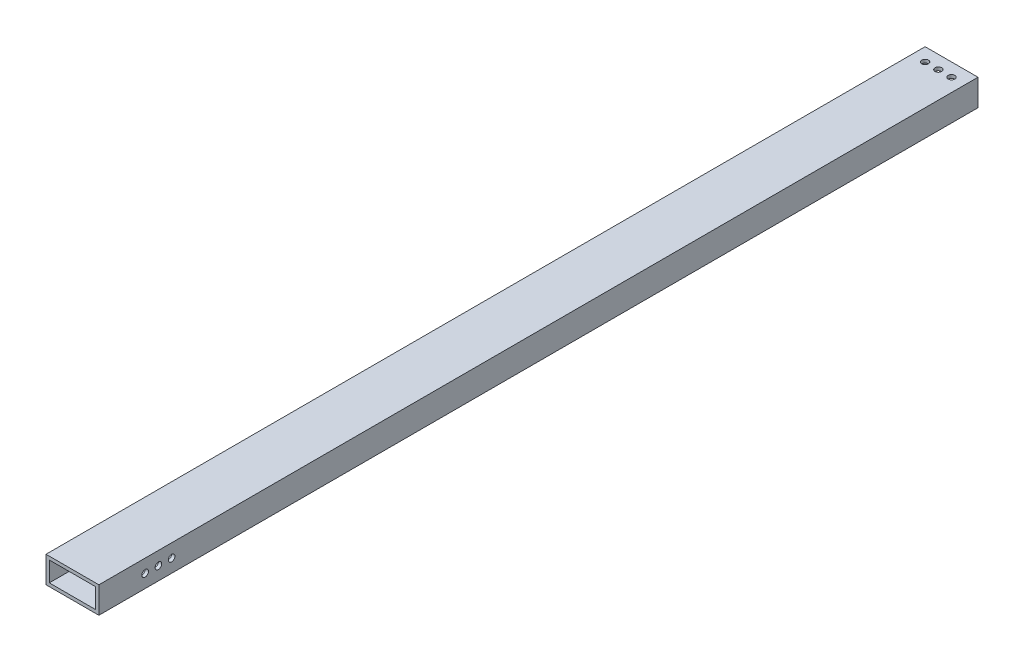
from build123d import *

# Parameters (mm, degrees)
SKETCH1_W                   = 50.8
SKETCH1_H                   = 25.4
SKETCH1_W_2                 = 44.45
SKETCH1_H_2                 = 19.05
BOSS_EXTRUDE1_DEPTH         = 844.55
CUT_EXTRUDE1_DEPTH          = 847.457620026
CUT_EXTRUDE1_DEPTH_BACK     = 847.457620026
SKETCH2_R                   = 3.175
F_1_4_0_25_DIAMETER_HOLE3_D = 6.35


with BuildPart() as part:
    # Sketch1 → Boss-Extrude1 (new body)
    with BuildSketch(Plane.XY):
        with Locations((25.4, 12.7)):
            Rectangle(SKETCH1_W, SKETCH1_H)
        with Locations((25.4, 12.7)):
            Rectangle(SKETCH1_W_2, SKETCH1_H_2, mode=Mode.SUBTRACT)
    extrude(amount=BOSS_EXTRUDE1_DEPTH)

    # Sketch2 → Cut-Extrude1 (cut, two sides: drawn at the far end of the back side and taken through both)
    with BuildSketch(Plane(origin=(50.8, 0, 0), x_dir=(0, 0, -1), z_dir=(1, 0, 0)).offset(-CUT_EXTRUDE1_DEPTH_BACK)):
        with Locations(Location((-800.1, 12.7, 0), (0, 0, 180))):
            Circle(SKETCH2_R)
        with Locations(Location((-787.4, 12.7, 0), (0, 0, 180))):
            Circle(SKETCH2_R)
        with Locations(Location((-774.7, 12.7, 0), (0, 0, 180))):
            Circle(SKETCH2_R)
    extrude(amount=CUT_EXTRUDE1_DEPTH + CUT_EXTRUDE1_DEPTH_BACK, mode=Mode.SUBTRACT)

    # 1/4 (0.25) Diameter Hole3 (through all)
    with Locations(Plane(origin=(0, 25.4, 0), x_dir=(1, 0, 0), z_dir=(0, 1, 0))):
        with Locations((12.7, -12.7), (25.4, -12.7), (38.1, -12.7)):
            Hole(F_1_4_0_25_DIAMETER_HOLE3_D / 2)


solid = part.part
